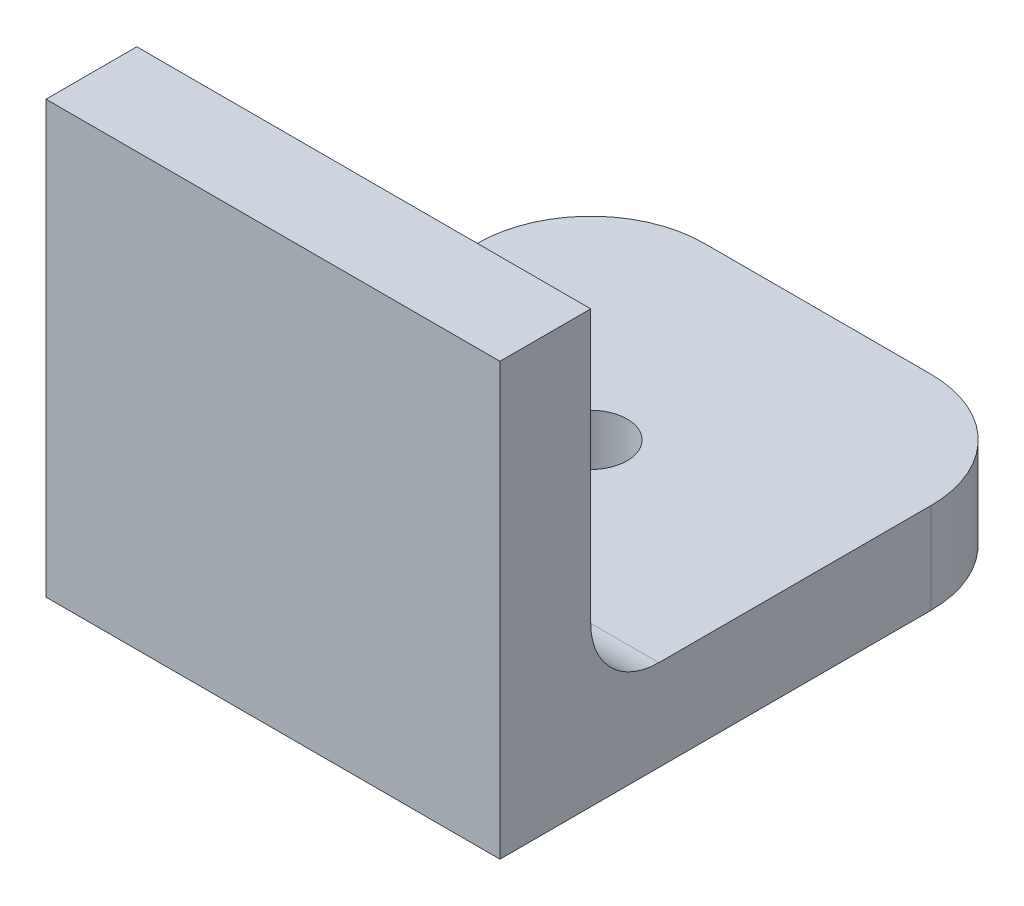
from build123d import *

# Parameters (mm, degrees)
SKETCH1_W           = 20
SKETCH1_H           = 20
SKETCH1_R           = 1.6
BOSS_EXTRUDE1_DEPTH = 4
SKETCH2_W           = 20
SKETCH2_H           = 4
BOSS_EXTRUDE2_DEPTH = 19
FILLET1_R           = 3
FILLET2_R           = 5


with BuildPart() as part:
    # Sketch1 → Boss-Extrude1 (new body)
    with BuildSketch(Plane(origin=(0, 0, 0), x_dir=(1, 0, 0), z_dir=(0, 1, 0))):
        with Locations((10, -10)):
            Rectangle(SKETCH1_W, SKETCH1_H)
        with Locations(Location((10, -10, 0), (0, 0, 270))):
            Circle(SKETCH1_R, mode=Mode.SUBTRACT)
    extrude(amount=BOSS_EXTRUDE1_DEPTH)

    # Sketch2 → Boss-Extrude2 (add)
    with BuildSketch(Plane(origin=(0, 0, 0), x_dir=(-1, 0, 0), z_dir=(0, -1, 0))):
        with Locations((-10, -22)):
            Rectangle(SKETCH2_W, SKETCH2_H)
    extrude(amount=-BOSS_EXTRUDE2_DEPTH)

    # Fillet1
    fillet1_edges = [part.edges().sort_by_distance(p)[0] for p in [
        (10, 4, 20),
    ]]
    fillet(fillet1_edges, radius=FILLET1_R)

    # Fillet2
    fillet2_edges = [part.edges().sort_by_distance(p)[0] for p in [
        (0, 2, 0),
        (20, 2, 0),
    ]]
    fillet(fillet2_edges, radius=FILLET2_R)


solid = part.part
